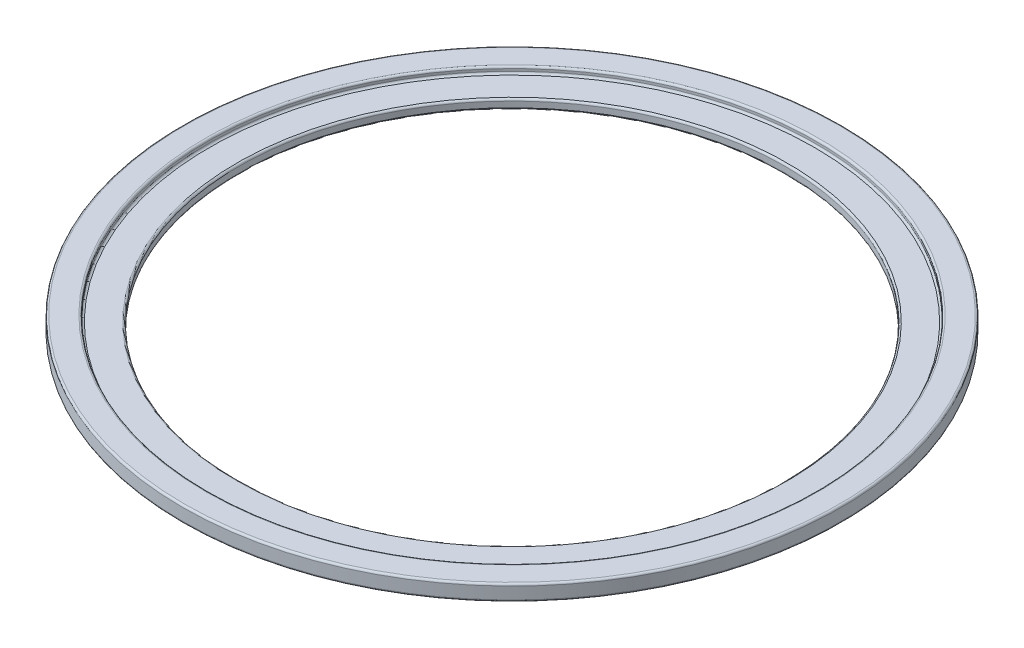
from build123d import *

# Parameters (mm, degrees)
FILETE1_R = 0.25


with BuildPart() as part:
    # Esboço1 → Revolução1 (revolve)
    with BuildSketch(Plane.XY):
        Polygon((35.25, 4.423200443), (35.25, 3.173200443), (42.5, 3.173200443), (42.5, 5.223200443), (39.25, 5.223200443), (39.25, 4.423200443), align=None)
    revolve(axis=Axis((0, 47.220653378, 0), (0, -1, 0)))

    # Filete1
    filete1_edges = [part.edges().sort_by_distance(p)[0] for p in [
        (-42.5, 3.173200443, 0),
        (-42.5, 5.223200443, 0),
        (-39.25, 5.223200443, 0),
        (-39.25, 4.423200443, 0),
        (-35.25, 4.423200443, 0),
        (-35.25, 3.173200443, 0),
    ]]
    fillet(filete1_edges, radius=FILETE1_R)


solid = part.part
